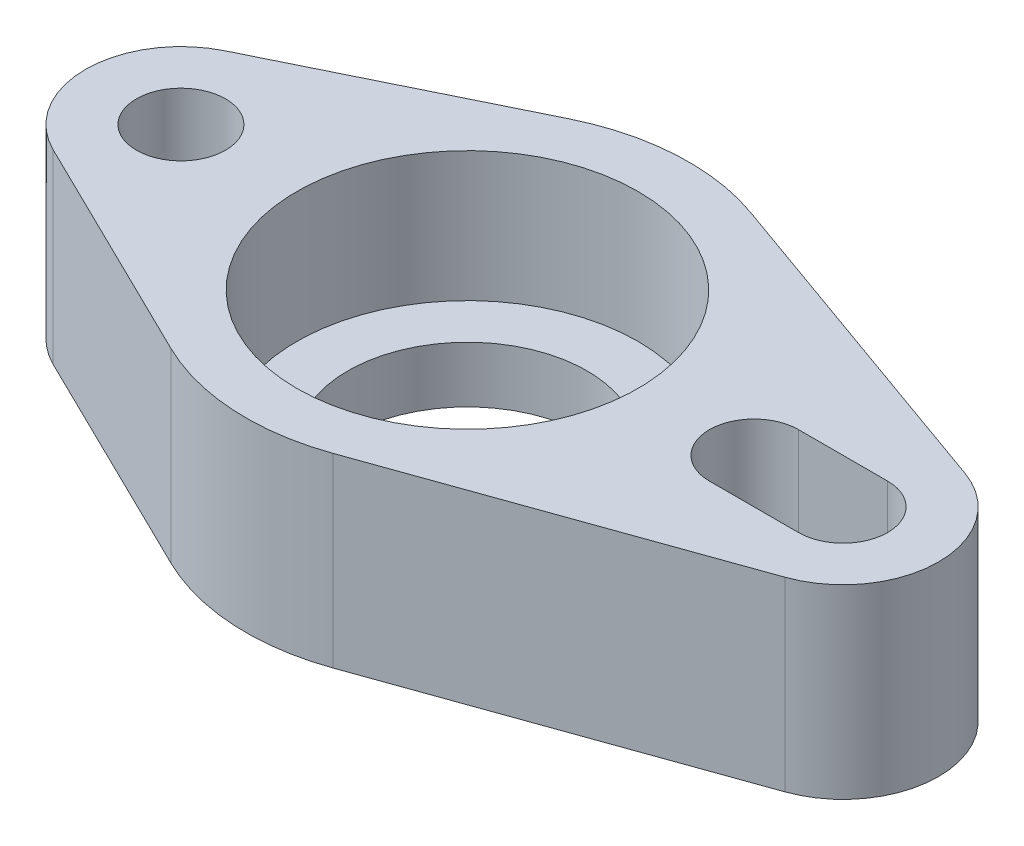
from build123d import *

# Parameters (mm, degrees)
SKETCH1_R     = 6.7
SKETCH1_R_2   = 1.75
BODY_DEPTH    = 7.3
SKETCH1_4_R   = 6.7
SKETCH1_4_R_2 = 4.7
FLOOR_2_DEPTH = 2.2


with BuildPart() as part:
    # Sketch1 → Body (new body)
    with BuildSketch(Plane(origin=(0, 0, 0), x_dir=(1, 0, 0), z_dir=(0, 1, 0))):
        with BuildLine():
            ThreePointArc((16.008474576, -3.532526255), (18.5, 0), (16.008474576, 3.532526255))
            Line((16.008474576, 3.532526255), (2.919661017, 8.195460911))
            ThreePointArc((2.919661017, 8.195460911), (-0.492868396, 8.686027904), (-3.828, 7.812580624))
            Line((-3.828, 7.812580624), (-12.9, 3.367491648))
            ThreePointArc((-12.9, 3.367491648), (-15, 0), (-12.9, -3.367491648))
            Line((-12.9, -3.367491648), (-3.828, -7.812580624))
            ThreePointArc((-3.828, -7.812580624), (-0.492868396, -8.686027904), (2.919661017, -8.195460911))
            Line((2.919661017, -8.195460911), (16.008474576, -3.532526255))
        make_face()
        with BuildLine():
            Line((11.25, 1.75), (14.75, 1.75))
            ThreePointArc((14.75, 1.75), (16.5, 0), (14.75, -1.75))
            Line((14.75, -1.75), (11.25, -1.75))
            ThreePointArc((11.25, -1.75), (9.5, 0), (11.25, 1.75))
        make_face(mode=Mode.SUBTRACT)
        Circle(SKETCH1_R, mode=Mode.SUBTRACT)
        with Locations((-11.25, 0)):
            Circle(SKETCH1_R_2, mode=Mode.SUBTRACT)
    extrude(amount=BODY_DEPTH)

    # Sketch1<4> → Floor 2 (add)
    with BuildSketch(Plane(origin=(0, 0, 0), x_dir=(1, 0, 0), z_dir=(0, 1, 0))):
        Circle(SKETCH1_4_R)
        Circle(SKETCH1_4_R_2, mode=Mode.SUBTRACT)
    extrude(amount=FLOOR_2_DEPTH)


solid = part.part
